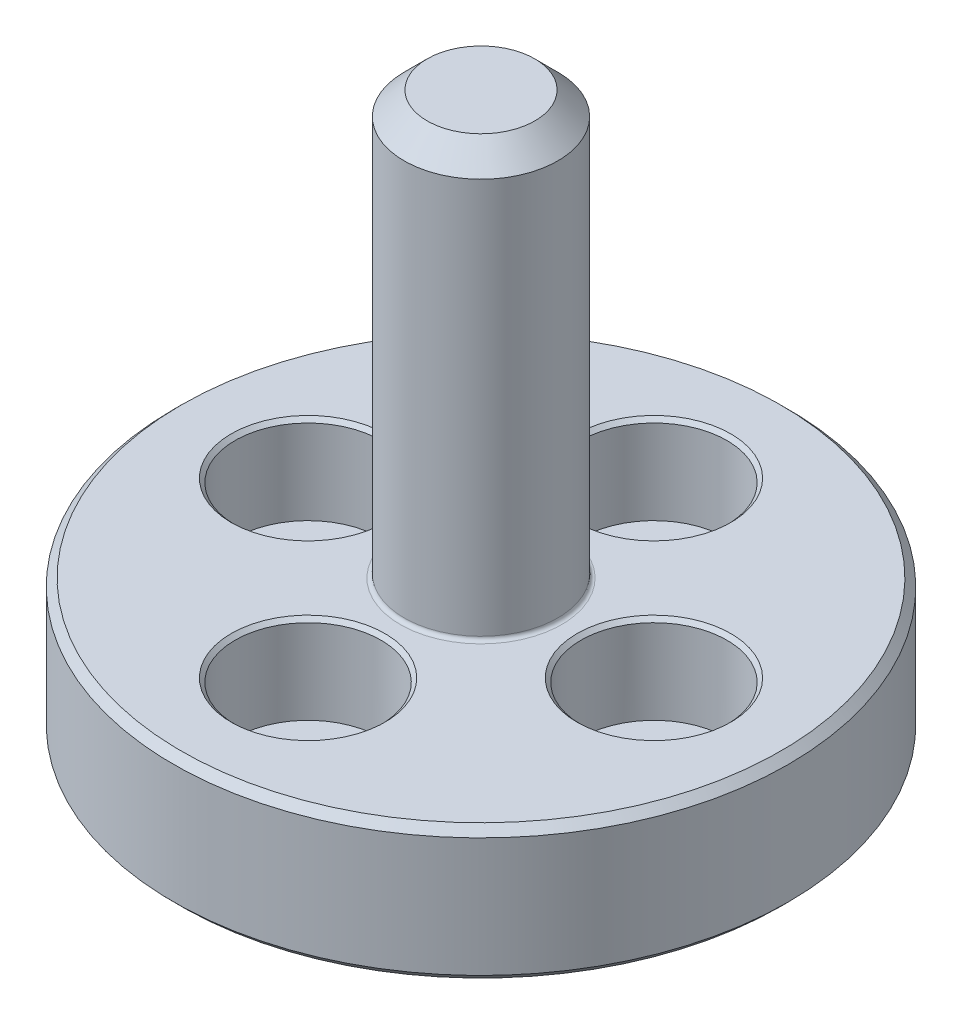
from build123d import *

# Parameters (mm, degrees)
SKIZZE3_R                       = 1.05
SCHNITT_LINEAR_AUSTRAGEN1_DEPTH = 16.779733838
SKIZZE4_R                       = 1.9
SCHNITT_LINEAR_AUSTRAGEN2_DEPTH = 2.3
FASE1_SIZE                      = 0.1
KREISMUSTER1_COUNT              = 4
FASE1_OF_KREISMUSTER1_SIZE      = 0.1
VERRUNDUNG1_R                   = 0.1
FASE2_SIZE                      = 0.6
SKIZZE5_R                       = 1
SCHNITT_LINEAR_AUSTRAGEN3_DEPTH = 4.5
FASE3_SIZE                      = 0.2


with BuildPart() as part:
    # Skizze2 → Rotation1 (revolve)
    with BuildSketch(Plane.XY):
        Polygon((0, 0), (8, 0), (8, 3.5), (2, 3.5), (2, 14.5), (0, 14.5), align=None)
    revolve(axis=Axis((0, 0, 0), (0, 1, 0)))

    # Skizze3 → Schnitt-Linear austragen1 (cut, through all)
    with BuildSketch(Plane(origin=(0, 3.5, 0), x_dir=(1, 0, 0), z_dir=(0, 1, 0))):
        with Locations(Location((0, 4.5, 0), (0, 0, 180))):
            Circle(SKIZZE3_R)
    schnitt_linear_austragen1 = extrude(amount=-SCHNITT_LINEAR_AUSTRAGEN1_DEPTH, mode=Mode.SUBTRACT)

    # Skizze4 → Schnitt-Linear austragen2 (cut)
    with BuildSketch(Plane(origin=(0, 3.5, 0), x_dir=(1, 0, 0), z_dir=(0, 1, 0))):
        with Locations(Location((0, 4.5, 0), (0, 0, 180))):
            Circle(SKIZZE4_R)
    schnitt_linear_austragen2 = extrude(amount=-SCHNITT_LINEAR_AUSTRAGEN2_DEPTH, mode=Mode.SUBTRACT)

    # Fase1
    fase1_edges = [part.edges().sort_by_distance(p)[0] for p in [
        (1.05, 0, -4.5),
        (1.9, 3.5, -4.5),
    ]]
    chamfer(fase1_edges, length=FASE1_SIZE)

    # Kreismuster1: Schnitt-Linear austragen1, Schnitt-Linear austragen2 ×4 about axis
    kreismuster1_axis = Axis((0, 0, 0), (0, 1, 0))
    add([schnitt_linear_austragen1.rotate(kreismuster1_axis, i * 360 / KREISMUSTER1_COUNT) for i in range(1, KREISMUSTER1_COUNT)], mode=Mode.SUBTRACT)
    add([schnitt_linear_austragen2.rotate(kreismuster1_axis, i * 360 / KREISMUSTER1_COUNT) for i in range(1, KREISMUSTER1_COUNT)], mode=Mode.SUBTRACT)

    # Fase1 of Kreismuster1
    fase1_of_kreismuster1_edges = [part.edges().sort_by_distance(p)[0] for p in [
        (-4.5, 0, -1.05),
        (-4.5, 3.5, -1.9),
        (-1.05, 0, 4.5),
        (-1.9, 3.5, 4.5),
        (4.5, 0, 1.05),
        (4.5, 3.5, 1.9),
    ]]
    chamfer(fase1_of_kreismuster1_edges, length=FASE1_OF_KREISMUSTER1_SIZE)

    # Verrundung1
    verrundung1_edges = [part.edges().sort_by_distance(p)[0] for p in [
        (-2, 3.5, 0),
    ]]
    fillet(verrundung1_edges, radius=VERRUNDUNG1_R)

    # Fase2
    fase2_edges = [part.edges().sort_by_distance(p)[0] for p in [
        (-2, 14.5, 0),
    ]]
    chamfer(fase2_edges, length=FASE2_SIZE)

    # Skizze5 → Schnitt-Linear austragen3 (cut)
    with BuildSketch(Plane.XZ):
        Circle(SKIZZE5_R)
    extrude(amount=-SCHNITT_LINEAR_AUSTRAGEN3_DEPTH, mode=Mode.SUBTRACT)

    # Fase3
    fase3_edges = [part.edges().sort_by_distance(p)[0] for p in [
        (-8, 3.5, 0),
        (-8, 0, 0),
        (-1, 0, 0),
    ]]
    chamfer(fase3_edges, length=FASE3_SIZE)


solid = part.part
